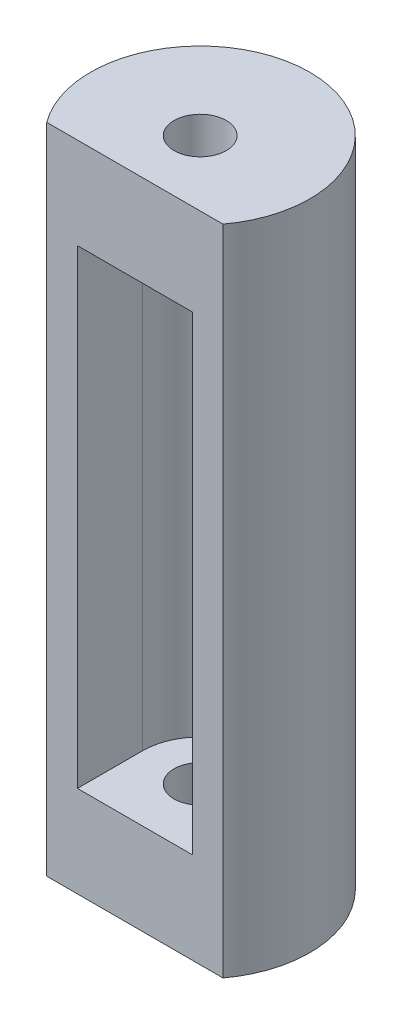
from build123d import *

# Parameters (mm, degrees)
SKETCH1_R           = 2
BOSS_EXTRUDE1_DEPTH = 7
BOSS_EXTRUDE3_DEPTH = 36
SKETCH5_R           = 2
BOSS_EXTRUDE4_DEPTH = 7


with BuildPart() as part:
    # Sketch1 → Boss-Extrude1 (new body)
    with BuildSketch(Plane(origin=(0, 0, 0), x_dir=(1, 0, 0), z_dir=(0, 1, 0))):
        with BuildLine():
            Line((6.749814812, -5), (-6.749814812, -5))
            ThreePointArc((-6.749814812, -5), (0, 8.4), (6.749814812, -5))
        make_face()
        with Locations(Location((0, 0, 0), (0, 0, 270))):
            Circle(SKETCH1_R, mode=Mode.SUBTRACT)
    extrude(amount=BOSS_EXTRUDE1_DEPTH)

    # Sketch3 → Boss-Extrude3 (add)
    with BuildSketch(Plane(origin=(0, 7, 0), x_dir=(1, 0, 0), z_dir=(0, 1, 0))):
        with BuildLine():
            Line((-4.4, 0), (-4.4, -5))
            Line((-4.4, -5), (-6.749814812, -5))
            ThreePointArc((-6.749814812, -5), (0, 8.4), (6.749814812, -5))
            Line((6.749814812, -5), (4.4, -5))
            Line((4.4, -5), (4.4, 0))
            ThreePointArc((4.4, 0), (0, 4.4), (-4.4, 0))
        make_face()
    extrude(amount=BOSS_EXTRUDE3_DEPTH)

    # Sketch5 → Boss-Extrude4 (add)
    with BuildSketch(Plane(origin=(0, 43, 0), x_dir=(1, 0, 0), z_dir=(0, 1, 0))):
        with BuildLine():
            Line((6.749814812, -5), (-6.749814812, -5))
            ThreePointArc((-6.749814812, -5), (0, 8.4), (6.749814812, -5))
        make_face()
        with Locations(Location((0, 0, 0), (0, 0, 270))):
            Circle(SKETCH5_R, mode=Mode.SUBTRACT)
    extrude(amount=BOSS_EXTRUDE4_DEPTH)


solid = part.part
